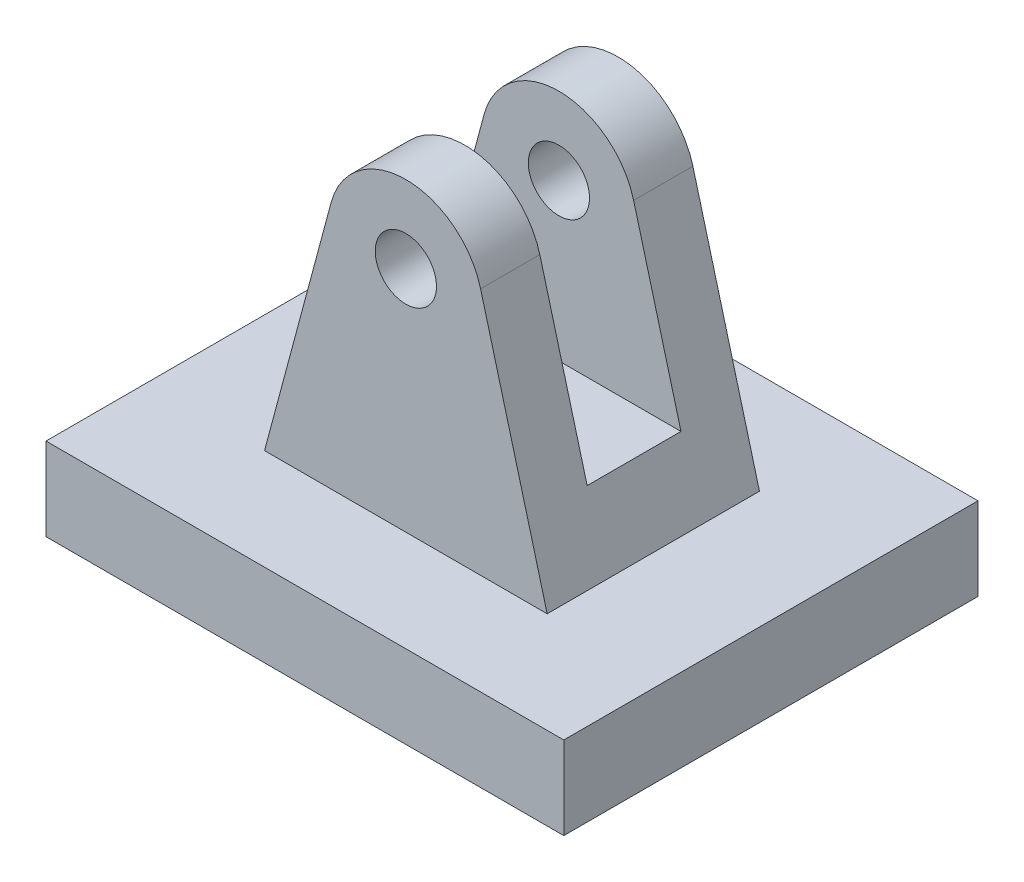
from build123d import *

# Parameters (mm, degrees)
SKETCH3_W               = 100
SKETCH3_H               = 80
BOSS_EXTRUDE2_DEPTH     = 16
BOSS_EXTRUDE3_DEPTH     = 20.5
SKETCH6_R               = 5.911815165
CUT_EXTRUDE1_DEPTH      = 109.559891304
CUT_EXTRUDE2_DEPTH      = 99.615414617
CUT_EXTRUDE2_DEPTH_BACK = 99.615414617
SKETCH8_W               = 18.118513472
SKETCH8_H               = 45.137164109


with BuildPart() as part:
    # Sketch3 → Boss-Extrude2 (new body)
    with BuildSketch(Plane(origin=(0, 0, 0), x_dir=(1, 0, 0), z_dir=(0, 1, 0))):
        Rectangle(SKETCH3_W, SKETCH3_H)
    extrude(amount=BOSS_EXTRUDE2_DEPTH)

    # Sketch5 → Boss-Extrude3 (add, symmetric)
    with BuildSketch(Plane.XY):
        with BuildLine():
            Line((-27.294131566, 16), (-14.434798789, 63.927620339))
            ThreePointArc((-14.434798789, 63.927620339), (0, 75), (14.434798789, 63.927620339))
            Line((14.434798789, 63.927620339), (27.294131566, 16))
            Line((27.294131566, 16), (-27.294131566, 16))
        make_face()
    extrude(amount=BOSS_EXTRUDE3_DEPTH, both=True)

    # Sketch6 → Cut-Extrude1 (cut, through all)
    with BuildSketch(Plane.XY.offset(20.5)):
        with Locations((0, 60.054657736)):
            Circle(SKETCH6_R)
    extrude(amount=-CUT_EXTRUDE1_DEPTH, mode=Mode.SUBTRACT)

    # Sketch8 → Cut-Extrude2 (cut, two sides: drawn at the far end of the back side and taken through both)
    with BuildSketch(Plane(origin=(0, 0, 0), x_dir=(0, 0, -1), z_dir=(1, 0, 0)).offset(-CUT_EXTRUDE2_DEPTH_BACK)):
        with Locations((0, 52.431417946)):
            Rectangle(SKETCH8_W, SKETCH8_H)
    extrude(amount=CUT_EXTRUDE2_DEPTH + CUT_EXTRUDE2_DEPTH_BACK, mode=Mode.SUBTRACT)


solid = part.part
